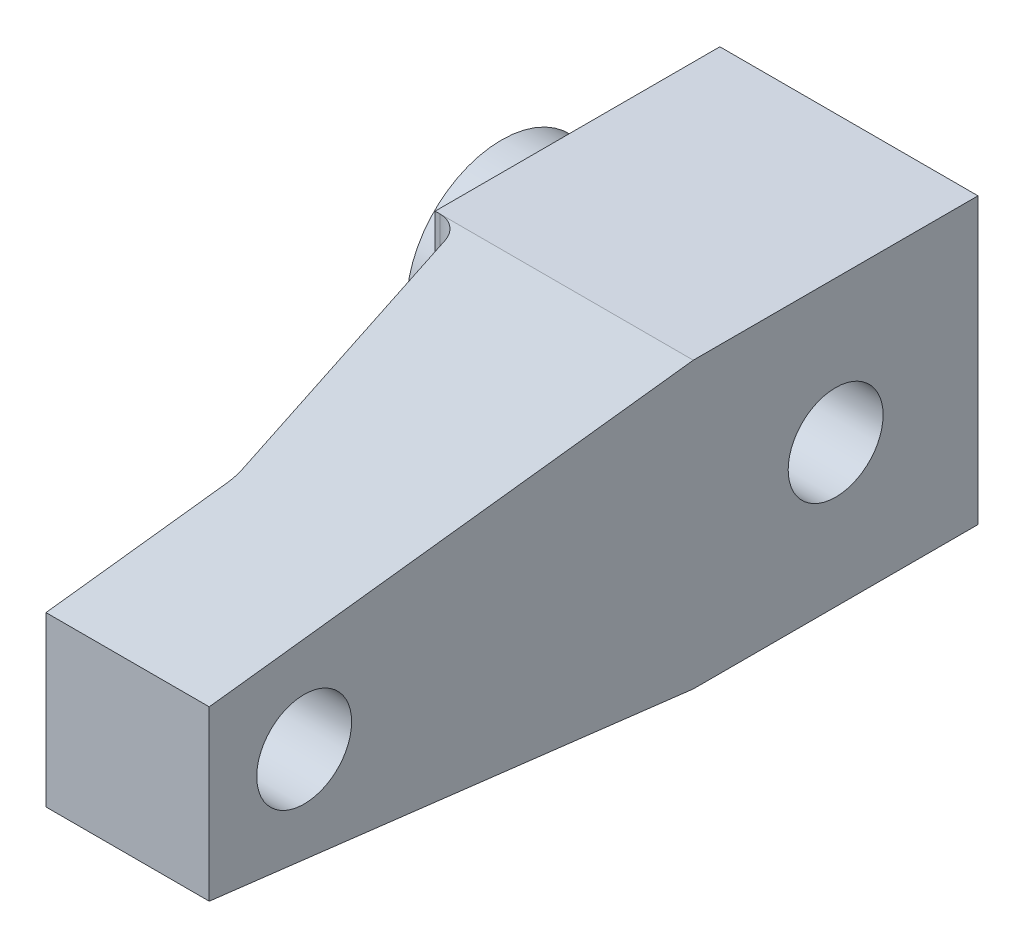
from build123d import *
from build123d.topology import SkipClean

# Parameters (mm, degrees)
SKETCH1_R               = 1.5875
BOSS_EXTRUDE1_DEPTH     = 8.636
CUT_EXTRUDE1_DEPTH      = 24.159747996
CUT_EXTRUDE1_DEPTH_BACK = 24.159747996
BOSS_EXTRUDE2_START     = 2.54
SKETCH3_R               = 3.175
SKETCH3_R_2             = 1.5875
BOSS_EXTRUDE2_DEPTH     = 2.54


with BuildPart() as part:
    # Sketch1 → Boss-Extrude1 (new body)
    with BuildSketch(Plane(origin=(0, 0, 0), x_dir=(0, 0, -1), z_dir=(1, 0, 0))):
        Polygon((4.7625, 4.7625), (4.7625, -4.7625), (-4.7625, -4.7625), (-20.955, -2.816231014), (-20.955, 2.816231014), (-4.7625, 4.7625), align=None)
        Circle(SKETCH1_R, mode=Mode.SUBTRACT)
        with Locations((-17.78, 0)):
            Circle(SKETCH1_R, mode=Mode.SUBTRACT)
    extrude(amount=BOSS_EXTRUDE1_DEPTH)

    # Sketch2 → Cut-Extrude1 (cut, two sides: drawn at the far end of the back side and taken through both)
    with BuildSketch(Plane(origin=(0, 0, 0), x_dir=(1, 0, 0), z_dir=(0, 1, 0)).offset(-CUT_EXTRUDE1_DEPTH_BACK)):
        with BuildLine():
            Line((0.940628704, -5.369598643), (3.103775286, -14.310604516))
            ThreePointArc((3.103775286, -14.310604516), (3.157130967, -14.607130839), (3.175, -14.907888859))
            Line((3.175, -14.907888859), (3.175, -20.955))
            Line((3.175, -20.955), (0, -20.955))
            Line((0, -20.955), (0, -4.7625))
            Line((0, -4.7625), (0.169136427, -4.7625))
            ThreePointArc((0.169136427, -4.7625), (0.659995138, -4.932473767), (0.940628704, -5.369598643))
        make_face()
    extrude(amount=CUT_EXTRUDE1_DEPTH + CUT_EXTRUDE1_DEPTH_BACK, mode=Mode.SUBTRACT)

    # Sketch3 → Boss-Extrude2 (add)
    with SkipClean():  # the faces are left unmerged after this step: merging them gives an invalid solid
        with BuildSketch(Plane.ZY.offset(BOSS_EXTRUDE2_START)):
            Circle(SKETCH3_R)
            Circle(SKETCH3_R_2, mode=Mode.SUBTRACT)
        extrude(amount=-BOSS_EXTRUDE2_DEPTH)


solid = part.part
